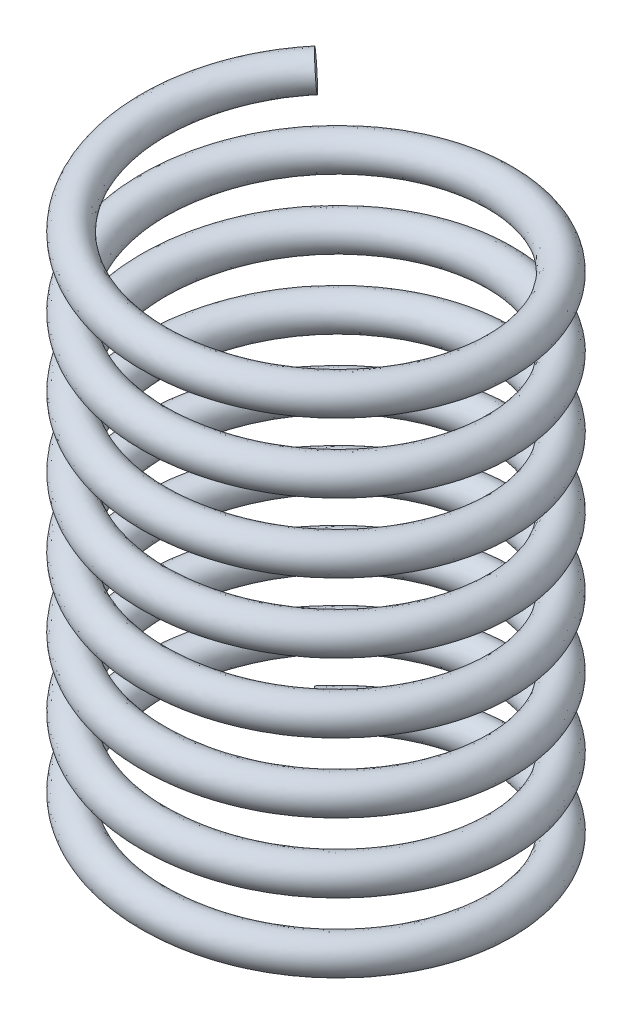
from build123d import *

# Parameters (mm, degrees)
SWEEP1_PITCH       = 1
SWEEP1_HEIGHT      = 8
SWEEP1_RADIUS      = 2.5
SWEEP1_START_ANGLE = -135
SWEEP1_PROFILE_R   = 0.25


with BuildPart() as part:
    # Sweep1: sweep along a helix
    with BuildLine() as sweep1_path:
        add(Helix(SWEEP1_PITCH, SWEEP1_HEIGHT, SWEEP1_RADIUS, center=(0, 0, 0), direction=(0, 1, 0), lefthand=True, mode=Mode.PRIVATE).rotate(Axis((0, 0, 0), (0, 1, 0)), SWEEP1_START_ANGLE))
    # Sweep1 profile (on start of the path) → Sweep1 (sweep)
    with BuildSketch(Plane(origin=(-1.767766953, 0, -1.767766953), x_dir=(-0.707106781186674, 0, -0.707106781186421), z_dir=(0.7056782240950671, 0.06353336191095392, -0.7056782240953196))):
        Circle(SWEEP1_PROFILE_R)
    sweep(path=sweep1_path.line, is_frenet=True)


solid = part.part
